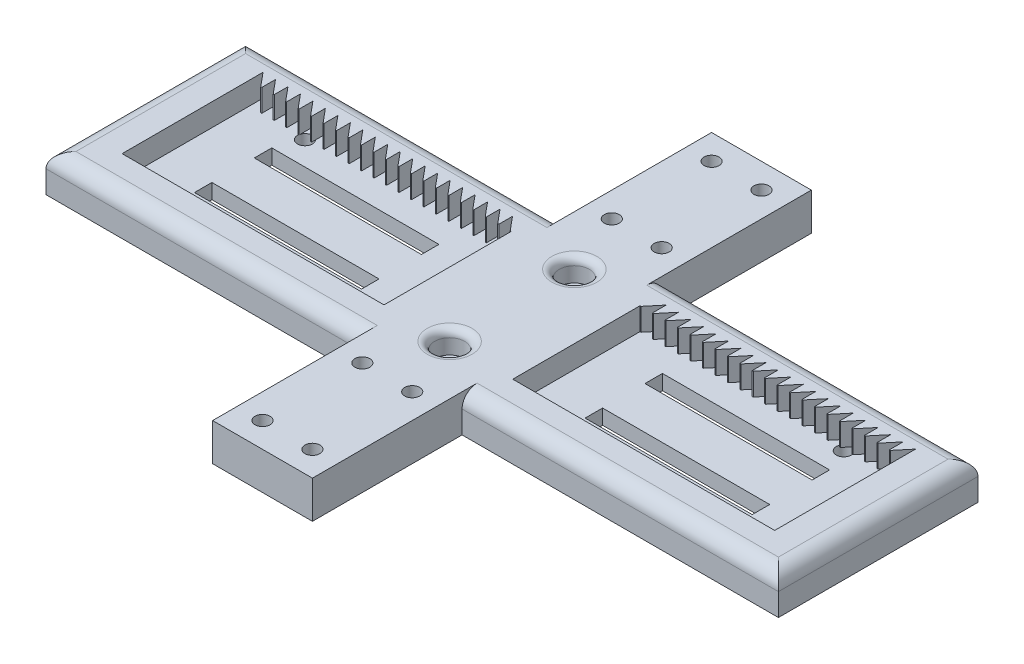
from build123d import *
from build123d.topology import SkipClean

# Parameters (mm, degrees)
SKETCH2_W           = 73.4
SKETCH2_H           = 40
BOSS_EXTRUDE1_DEPTH = 3
SKETCH2_3_W         = 73.4
SKETCH2_3_H         = 40
BOSS_EXTRUDE2_DEPTH = 4.5
SKETCH3_W           = 33.5
SKETCH3_H           = 3.5
CUT_EXTRUDE1_DEPTH  = 77.208988971
SKETCH4_R           = 1.75
CUT_EXTRUDE3_DEPTH  = 77.444816698
SKETCH5_R           = 3
CUT_EXTRUDE4_DEPTH  = 4.5
SKETCH7_R           = 1.5
CUT_EXTRUDE5_DEPTH  = 3
SKETCH9_W           = 10
SKETCH9_H           = 30
BOSS_EXTRUDE3_DEPTH = 7.5
SKETCH10_R          = 1.5
CUT_EXTRUDE6_DEPTH  = 6
FILLET2_R           = 3
FILLET3_R           = 1.5


with BuildPart() as part:
    # Sketch2 → Boss-Extrude1 (new body)
    with BuildSketch(Plane(origin=(0, 0, 0), x_dir=(1, 0, 0), z_dir=(0, 1, 0))):
        with Locations((-36.7, 0)):
            Rectangle(SKETCH2_W, SKETCH2_H)
    extrude(amount=-BOSS_EXTRUDE1_DEPTH)

    # Sketch2<3> → Boss-Extrude2 (add)
    with BuildSketch(Plane(origin=(0, 0, 0), x_dir=(1, 0, 0), z_dir=(0, 1, 0))):
        with Locations((-36.7, 0)):
            Rectangle(SKETCH2_3_W, SKETCH2_3_H)
        Polygon((-12.9, 12.75), (-12.9, 12.5), (-12.9, -12.75), (-65.4, -12.75), (-65.4, 12.5), (-65.4, 12.75), (-65.4, 15.5), (-63.108333333, 12.75), (-62.9, 12.75), (-62.9, 15.5), (-60.608333333, 12.75), (-60.4, 12.75), (-60.4, 15.5), (-58.108333333, 12.75), (-57.9, 12.75), (-57.9, 15.5), (-55.608333333, 12.75), (-55.4, 12.75), (-55.4, 15.5), (-53.108333333, 12.75), (-52.9, 12.75), (-52.9, 15.5), (-50.608333333, 12.75), (-50.4, 12.75), (-50.4, 15.5), (-48.108333333, 12.75), (-47.9, 12.75), (-47.9, 15.5), (-45.608333333, 12.75), (-45.4, 12.75), (-45.4, 15.5), (-43.108333333, 12.75), (-42.9, 12.75), (-42.9, 15.5), (-40.608333333, 12.75), (-40.4, 12.75), (-40.4, 15.5), (-38.108333333, 12.75), (-37.9, 12.75), (-37.9, 15.5), (-35.608333333, 12.75), (-35.4, 12.75), (-35.4, 15.5), (-33.108333333, 12.75), (-32.9, 12.75), (-32.9, 15.5), (-30.608333333, 12.75), (-30.4, 12.75), (-30.4, 15.5), (-28.108333333, 12.75), (-27.9, 12.75), (-27.9, 15.5), (-25.608333333, 12.75), (-25.4, 12.75), (-25.4, 15.5), (-23.108333333, 12.75), (-22.9, 12.75), (-22.9, 15.5), (-20.608333333, 12.75), (-20.4, 12.75), (-20.4, 15.5), (-18.108333333, 12.75), (-17.9, 12.75), (-17.9, 15.5), (-15.608333333, 12.75), (-15.4, 12.75), (-15.4, 15.5), (-13.108333333, 12.75), align=None, mode=Mode.SUBTRACT)
    extrude(amount=BOSS_EXTRUDE2_DEPTH)

    # Sketch3 → Cut-Extrude1 (cut, through all)
    with BuildSketch(Plane(origin=(0, 0, 0), x_dir=(1, 0, 0), z_dir=(0, 1, 0))):
        with Locations((-39.15, 6)):
            Rectangle(SKETCH3_W, SKETCH3_H)
        with Locations((-39.15, -6)):
            Rectangle(SKETCH3_W, SKETCH3_H)
        with Locations((24.27, 6)):
            Rectangle(SKETCH3_W, SKETCH3_H)
        with Locations((24.27, -6)):
            Rectangle(SKETCH3_W, SKETCH3_H)
    extrude(amount=-CUT_EXTRUDE1_DEPTH, mode=Mode.SUBTRACT)

    # Sketch4 → Cut-Extrude3 (cut, through all)
    with BuildSketch(Plane(origin=(0, 4.5, 0), x_dir=(1, 0, 0), z_dir=(0, 1, 0))):
        with Locations((0, 12.5)):
            Circle(SKETCH4_R)
        with Locations((0, -12.5)):
            Circle(SKETCH4_R)
    extrude(amount=-CUT_EXTRUDE3_DEPTH, mode=Mode.SUBTRACT)

    # Sketch5 → Cut-Extrude4 (cut)
    with BuildSketch(Plane(origin=(0, 4.5, 0), x_dir=(1, 0, 0), z_dir=(0, 1, 0))):
        with Locations((0, 12.5)):
            Circle(SKETCH5_R)
        with Locations((0, -12.5)):
            Circle(SKETCH5_R)
    extrude(amount=-CUT_EXTRUDE4_DEPTH, mode=Mode.SUBTRACT)

    # Sketch7 → Cut-Extrude5 (cut)
    with BuildSketch(Plane.XZ.offset(3)):
        with Locations(Location((-54, 12.5, 0), (0, 0, 270))):
            Circle(SKETCH7_R)
        with Locations(Location((-54, -12.5, 0), (0, 0, 270))):
            Circle(SKETCH7_R)
    extrude(amount=-CUT_EXTRUDE5_DEPTH, mode=Mode.SUBTRACT)

    # Sketch9 → Boss-Extrude3 (add)
    with BuildSketch(Plane(origin=(0, 4.5, 0), x_dir=(1, 0, 0), z_dir=(0, 1, 0))):
        with Locations((-5, 35)):
            Rectangle(SKETCH9_W, SKETCH9_H)
        with Locations((-5, -35)):
            Rectangle(SKETCH9_W, SKETCH9_H)
    extrude(amount=-BOSS_EXTRUDE3_DEPTH)

    # Sketch10 → Cut-Extrude6 (cut)
    with BuildSketch(Plane(origin=(0, 4.5, 0), x_dir=(1, 0, 0), z_dir=(0, 1, 0))):
        with Locations(Location((-5, 25, 0), (0, 0, 270))):
            Circle(SKETCH10_R)
        with Locations(Location((-5, -25, 0), (0, 0, 270))):
            Circle(SKETCH10_R)
        with Locations(Location((-5, -45, 0), (0, 0, 270))):
            Circle(SKETCH10_R)
        with Locations(Location((-5, 45, 0), (0, 0, 270))):
            Circle(SKETCH10_R)
    extrude(amount=-CUT_EXTRUDE6_DEPTH, mode=Mode.SUBTRACT)

    # Mirror1: part across plane


with BuildPart() as part_1:
    with SkipClean():  # the faces are left unmerged after this step: merging them gives an invalid solid
        add(part.part)
        add(part.part.mirror(Plane(origin=(0, 0, 0), x_dir=(0, 0, 1), z_dir=(1, 0, 0))))

    # Fillet2
    fillet2_edges = [part_1.edges().sort_by_distance(p)[0] for p in [
        (41.7, 4.5, -20),
        (41.7, 4.5, 20),
        (73.4, 4.5, 0),
        (-41.7, 4.5, -20),
        (-73.4, 4.5, 0),
        (-41.7, 4.5, 20),
    ]]
    fillet(fillet2_edges, radius=FILLET2_R)

    # Fillet3
    fillet3_edges = [part_1.edges().sort_by_distance(p)[0] for p in [
        (-3, 4.5, -12.5),
        (-3, 4.5, 12.5),
    ]]
    fillet(fillet3_edges, radius=FILLET3_R)


solid = part_1.part
